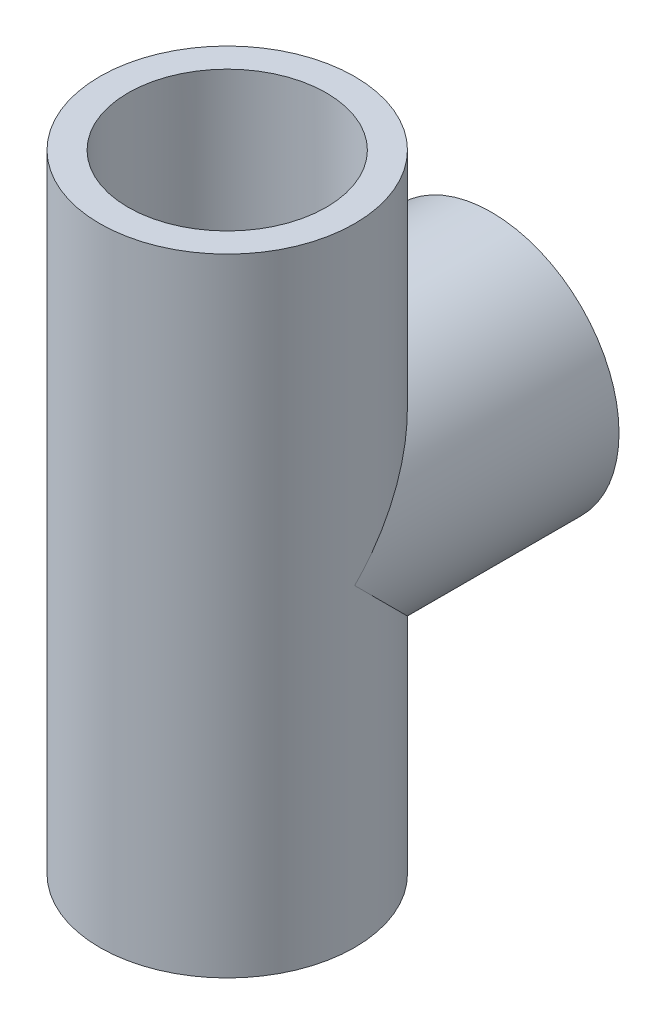
from build123d import *

# Parameters (mm, degrees)
SKETCH1_R           = 17.145
SKETCH1_R_2         = 13.335
BOSS_EXTRUDE1_DEPTH = 84.328
SKETCH2_R           = 17.145
SKETCH2_R_2         = 13.335
BOSS_EXTRUDE2_DEPTH = 35.56
SKETCH3_R           = 13.335
CUT_EXTRUDE1_DEPTH  = 94.111096186
CUT_EXTRUDE2_START  = -35.56
SKETCH4_R           = 13.335
CUT_EXTRUDE2_DEPTH  = 35.56


with BuildPart() as part:
    # Sketch1 → Boss-Extrude1 (new body)
    with BuildSketch(Plane(origin=(0, 0, 0), x_dir=(1, 0, 0), z_dir=(0, 1, 0))):
        with Locations(Location((0, 0, 0), (0, 0, 270))):
            Circle(SKETCH1_R)
        with Locations(Location((0, 0, 0), (0, 0, 270))):
            Circle(SKETCH1_R_2, mode=Mode.SUBTRACT)
    extrude(amount=BOSS_EXTRUDE1_DEPTH)

    # Sketch2 → Boss-Extrude2 (add)
    with BuildSketch(Plane.XY):
        with Locations((0, 42.164)):
            Circle(SKETCH2_R)
        with Locations((0, 42.164)):
            Circle(SKETCH2_R_2, mode=Mode.SUBTRACT)
    extrude(amount=-BOSS_EXTRUDE2_DEPTH)

    # Sketch3 → Cut-Extrude1 (cut, through all)
    with BuildSketch(Plane(origin=(0, 84.328, 0), x_dir=(1, 0, 0), z_dir=(0, 1, 0))):
        with Locations(Location((0, 0, 0), (0, 0, 270))):
            Circle(SKETCH3_R)
    extrude(amount=-CUT_EXTRUDE1_DEPTH, mode=Mode.SUBTRACT)

    # Sketch4 → Cut-Extrude2 (cut)
    with BuildSketch(Plane(origin=(0, 0, -35.56), x_dir=(-1, 0, 0), z_dir=(0, 0, -1)).offset(CUT_EXTRUDE2_START)):
        with Locations(Location((0, 42.164, 0), (0, 0, 180))):
            Circle(SKETCH4_R)
    extrude(amount=CUT_EXTRUDE2_DEPTH, mode=Mode.SUBTRACT)


solid = part.part
